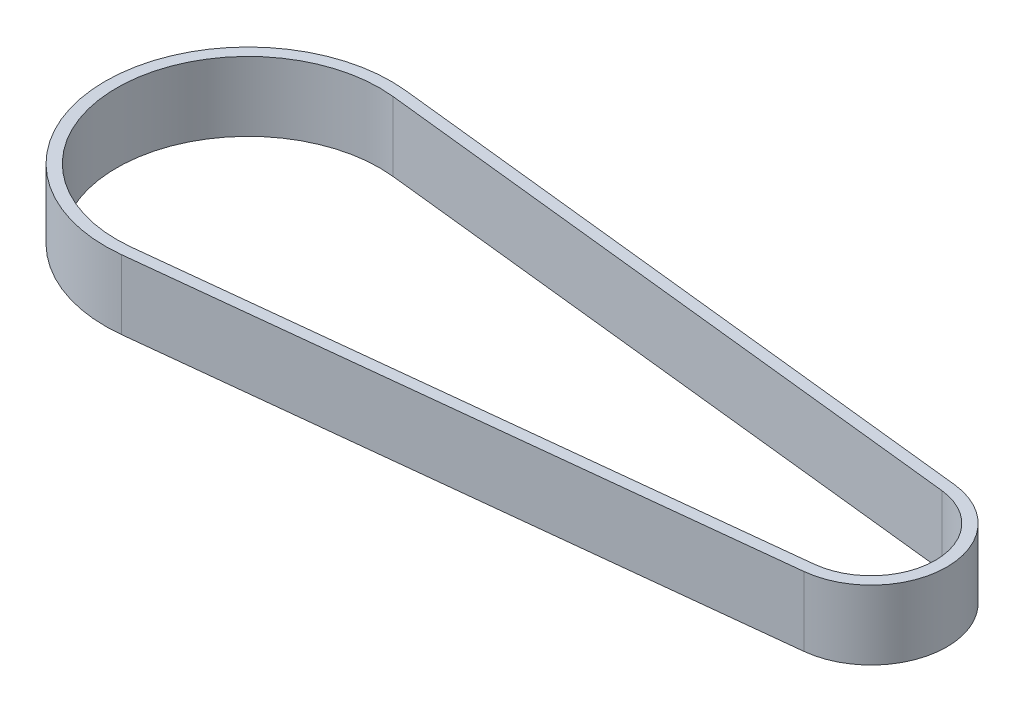
from build123d import *

# Parameters (mm, degrees)
BOSS_EXTRUDE1_DEPTH = 6


with BuildPart() as part:
    # Sketch1 → Boss-Extrude1 (new body)
    with BuildSketch(Plane(origin=(0, 0, 0), x_dir=(1, 0, 0), z_dir=(0, 1, 0))):
        with BuildLine():
            Line((-50.425515684, -12.317579419), (2.945060242, -6.521656254))
            ThreePointArc((2.945060242, -6.521656254), (8.796823205, 0), (2.945060242, 6.521656254))
            Line((2.945060242, 6.521656254), (-50.425515684, 12.317579419))
            ThreePointArc((-50.425515684, 12.317579419), (-64.153176795, 0), (-50.425515684, -12.317579419))
        make_face()
        with BuildLine():
            Line((-50.533478647, -11.323424503), (2.837097279, -5.527501337))
            ThreePointArc((2.837097279, -5.527501337), (7.796823205, 0), (2.837097279, 5.527501337))
            Line((2.837097279, 5.527501337), (-50.533478647, 11.323424503))
            ThreePointArc((-50.533478647, 11.323424503), (-63.153176795, 0), (-50.533478647, -11.323424503))
        make_face(mode=Mode.SUBTRACT)
    extrude(amount=BOSS_EXTRUDE1_DEPTH)


solid = part.part
